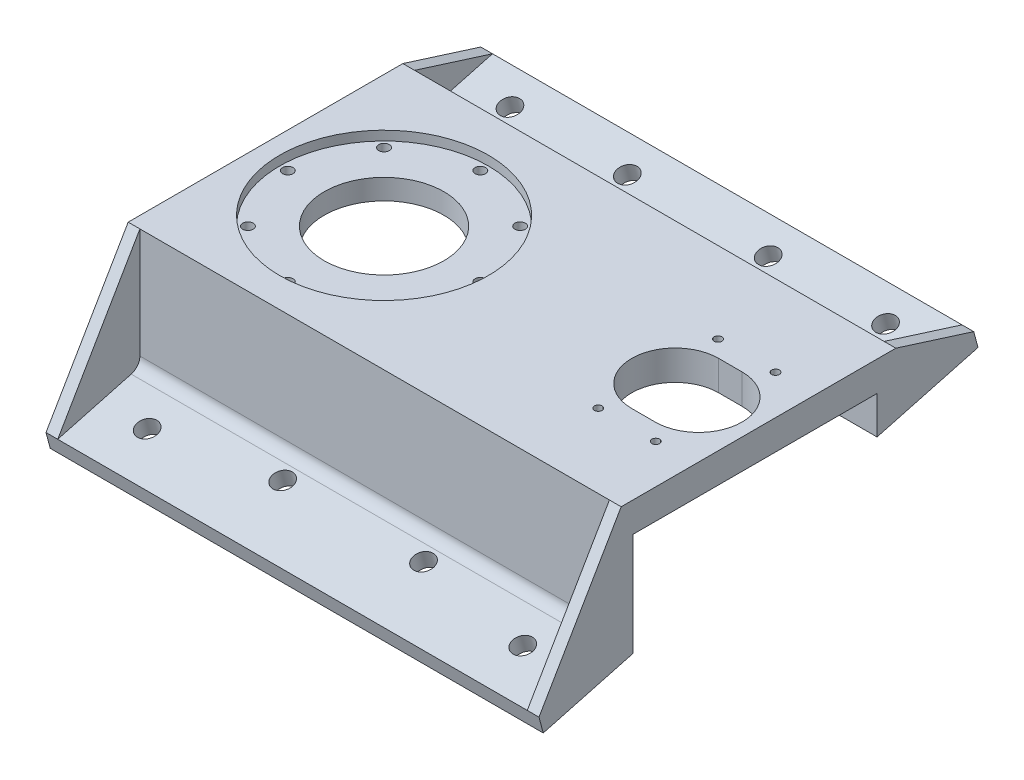
from build123d import *

# Parameters (mm, degrees)
EXTRUDE_1_DEPTH      = 30
SKETCH_2_R           = 44.45
CUT_EXTRUDE_1_DEPTH  = 4
SKETCH_3_R           = 25.5
SKETCH_3_R_2         = 2.25
CUT_EXTRUDE_2_DEPTH  = 188.619295383
CUT_EXTRUDE_3_DEPTH  = 189.215302247
SKETCH_5_R           = 1.65
CUT_EXTRUDE_4_DEPTH  = 189.215302247
EXTRUDE_START        = -30
EXTRUDE_2_DEPTH      = 30
CUT_EXTRUDE_5_DEPTH  = 198.040604952
CUT_EXTRUDE_7_DEPTH  = 233.432785983
CUT_EXTRUDE_8_DEPTH  = 233.432785983
CUT_EXTRUDE_9_DEPTH  = 233.432785983
FILLET_1_R           = 5
CUT_EXTRUDE_10_DEPTH = 233.432785983
EXTRUDE_START_2      = -5
EXTRUDE_3_DEPTH      = 5
EXTRUDE_4_DEPTH      = 5
SKETCH_14_R          = 4.25
CUT_EXTRUDE_11_DEPTH = 189.364728478
SKETCH_16_W          = 43
SKETCH_16_H          = 30
CUT_EXTRUDE_12_DEPTH = 233.432785983
EXTRUDE_7_REACH      = 188.592
SKETCH_18_W          = 210
SKETCH_18_H          = 5
EXTRUDE_8_DEPTH      = 210
EXTRUDE_9_DEPTH      = 5
EXTRUDE_10_DEPTH     = 5
SKETCH_22_R          = 4.25
CUT_EXTRUDE_13_DEPTH = 187.984035343
FILLET_2_R           = 5


with BuildPart() as part:
    # 草图1 → 凸台-拉伸1 (new body)
    with BuildSketch(Plane(origin=(0, 0, 0), x_dir=(1, 0, 0), z_dir=(0, 1, 0))):
        with BuildLine():
            Line((170, 31.93), (170, -31.93))
            ThreePointArc((170, -31.93), (167.781993847, -38.210172909), (162.111885646, -41.704453387))
            Line((162.111885646, -41.704453387), (15.839142344, -73.308400404))
            ThreePointArc((15.839142344, -73.308400404), (-75, 0), (15.839142344, 73.308400404))
            Line((15.839142344, 73.308400404), (162.111885646, 41.704453387))
            ThreePointArc((162.111885646, 41.704453387), (167.781993847, 38.210172909), (170, 31.93))
        make_face()
    extrude(amount=EXTRUDE_1_DEPTH)

    # 草图2 → 切除-拉伸1 (cut)
    with BuildSketch(Plane(origin=(0, 30, 0), x_dir=(1, 0, 0), z_dir=(0, 1, 0))):
        with Locations(Location((0, 0, 0), (0, 0, 270))):
            Circle(SKETCH_2_R)
    extrude(amount=-CUT_EXTRUDE_1_DEPTH, mode=Mode.SUBTRACT)

    # 草图3 → 切除-拉伸2 (cut, through all)
    with BuildSketch(Plane(origin=(0, 26, 0), x_dir=(1, 0, 0), z_dir=(0, 1, 0))):
        with Locations(Location((0, 0, 0), (0, 0, 270))):
            Circle(SKETCH_3_R)
        with Locations(Location((0, 41, 0), (0, 0, 270))):
            Circle(SKETCH_3_R_2)
        with Locations(Location((28.991378029, 28.991378029, 0), (0, 0, 270))):
            Circle(SKETCH_3_R_2)
        with Locations(Location((41, 0, 0), (0, 0, 270))):
            Circle(SKETCH_3_R_2)
        with Locations(Location((28.991378029, -28.991378029, 0), (0, 0, 270))):
            Circle(SKETCH_3_R_2)
        with Locations(Location((0, -41, 0), (0, 0, 270))):
            Circle(SKETCH_3_R_2)
        with Locations(Location((-28.991378029, -28.991378029, 0), (0, 0, 270))):
            Circle(SKETCH_3_R_2)
        with Locations(Location((-41, 0, 0), (0, 0, 270))):
            Circle(SKETCH_3_R_2)
        with Locations(Location((-28.991378029, 28.991378029, 0), (0, 0, 270))):
            Circle(SKETCH_3_R_2)
    extrude(amount=-CUT_EXTRUDE_2_DEPTH, mode=Mode.SUBTRACT)

    # 草图4 → 切除-拉伸3 (cut, through all)
    with BuildSketch(Plane(origin=(0, 30, 0), x_dir=(1, 0, 0), z_dir=(0, 1, 0))):
        with BuildLine():
            Line((124, 18.5), (134, 18.5))
            ThreePointArc((134, 18.5), (152.5, 0), (134, -18.5))
            Line((134, -18.5), (124, -18.5))
            ThreePointArc((124, -18.5), (105.5, 0), (124, 18.5))
        make_face()
    extrude(amount=-CUT_EXTRUDE_3_DEPTH, mode=Mode.SUBTRACT)

    # 草图5 → 切除-拉伸4 (cut, through all)
    with BuildSketch(Plane(origin=(0, 30, 0), x_dir=(1, 0, 0), z_dir=(0, 1, 0))):
        with Locations(Location((116.75, 25.5, 0), (0, 0, 270))):
            Circle(SKETCH_5_R)
        with Locations(Location((141.25, 25.5, 0), (0, 0, 270))):
            Circle(SKETCH_5_R)
        with Locations(Location((141.25, -25.5, 0), (0, 0, 270))):
            Circle(SKETCH_5_R)
        with Locations(Location((116.75, -25.5, 0), (0, 0, 270))):
            Circle(SKETCH_5_R)
    extrude(amount=-CUT_EXTRUDE_4_DEPTH, mode=Mode.SUBTRACT)

    # 草图6 → 凸台-拉伸2 (add)
    with BuildSketch(Plane(origin=(0, 30, 0), x_dir=(1, 0, 0), z_dir=(0, 1, 0)).offset(EXTRUDE_START)):
        with BuildLine():
            Line((158, 95), (-52, 95))
            Line((-52, 95), (-52, 54.046276467))
            ThreePointArc((-52, 54.046276467), (-20.48558667, 72.148047366), (15.839142344, 73.308400404))
            Line((15.839142344, 73.308400404), (158, 42.592874655))
            Line((158, 42.592874655), (158, 95))
        make_face()
        with BuildLine():
            ThreePointArc((15.839142344, -73.308400404), (-20.48558667, -72.148047366), (-52, -54.046276467))
            Line((-52, -54.046276467), (-52, -95))
            Line((-52, -95), (158, -95))
            Line((158, -95), (158, -42.592874655))
            Line((158, -42.592874655), (15.839142344, -73.308400404))
        make_face()
    extrude(amount=EXTRUDE_2_DEPTH)

    # 草图7 → 切除-拉伸5 (cut, through all)
    with BuildSketch(Plane(origin=(0, 30, 0), x_dir=(1, 0, 0), z_dir=(0, 1, 0))):
        with BuildLine():
            Line((-52, 54.046276467), (-52, -54.046276467))
            ThreePointArc((-52, -54.046276467), (-75, 0), (-52, 54.046276467))
        make_face()
        with BuildLine():
            Line((158, 42.592874655), (158, -42.592874655))
            Line((158, -42.592874655), (162.111885646, -41.704453387))
            ThreePointArc((162.111885646, -41.704453387), (167.781993847, -38.210172909), (170, -31.93))
            Line((170, -31.93), (170, 31.93))
            ThreePointArc((170, 31.93), (167.781993847, 38.210172909), (162.111885646, 41.704453387))
            Line((162.111885646, 41.704453387), (158, 42.592874655))
        make_face()
    extrude(amount=-CUT_EXTRUDE_5_DEPTH, mode=Mode.SUBTRACT)

    # 草图9 → 切除-拉伸7 (cut, through all)
    with BuildSketch(Plane.ZY.offset(52)):
        Polygon((-95, 20), (-60, 10.621778265), (-60, 30), (-95, 30), align=None)
    extrude(amount=-CUT_EXTRUDE_7_DEPTH, mode=Mode.SUBTRACT)

    # 草图10 → 切除-拉伸8 (cut, through all)
    with BuildSketch(Plane.ZY.offset(52)):
        Polygon((-95, 12.753066737), (-52, 1.231251463), (-52, 0), (-95, 0), align=None)
    extrude(amount=-CUT_EXTRUDE_8_DEPTH, mode=Mode.SUBTRACT)

    # 草图8 → 切除-拉伸9 (cut, through all)
    with BuildSketch(Plane.ZY.offset(52)):
        Polygon((0, 0), (52, 0), (52, 17.3), (-52, 17.3), (-52, 0), align=None)
    extrude(amount=-CUT_EXTRUDE_9_DEPTH, mode=Mode.SUBTRACT)

    # 圆角1
    fillet_1_edges = [part.edges().sort_by_distance(p)[0] for p in [
        (53, 10.621778265, -60),
    ]]
    fillet(fillet_1_edges, radius=FILLET_1_R)

    # 草图11 → 切除-拉伸10 (cut, through all)
    with BuildSketch(Plane.ZY.offset(52)):
        Polygon((-95, 12.753066737), (-93.188266684, 19.514547521), (-95, 20), align=None)
    extrude(amount=-CUT_EXTRUDE_10_DEPTH, mode=Mode.SUBTRACT)

    # 草图12 → 凸台-拉伸3 (add)
    with BuildSketch(Plane.ZY.offset(52).offset(EXTRUDE_START_2)):
        with BuildLine():
            Line((-93.188266684, 19.514547521), (-60, 30))
            Line((-60, 30), (-60, 17.137905129))
            ThreePointArc((-60, 17.137905129), (-61.956192855, 13.171138428), (-66.294095226, 12.308275998))
            Line((-66.294095226, 12.308275998), (-93.188266684, 19.514547521))
        make_face()
    extrude(amount=EXTRUDE_3_DEPTH)

    # 草图13 → 凸台-拉伸4 (add)
    with BuildSketch(Plane(origin=(158, 0, 0), x_dir=(0, 0, -1), z_dir=(1, 0, 0))):
        with BuildLine():
            Line((66.294095226, 12.308275998), (93.188266684, 19.514547521))
            Line((93.188266684, 19.514547521), (60, 30))
            Line((60, 30), (60, 17.137905129))
            ThreePointArc((60, 17.137905129), (61.956192855, 13.171138428), (66.294095226, 12.308275998))
        make_face()
    extrude(amount=-EXTRUDE_4_DEPTH)

    # 草图14 → 切除-拉伸11 (cut, through all)
    with BuildSketch(Plane(origin=(0, -5.089745962, -1.36379332), x_dir=(1, 0, 0), z_dir=(0, 0.9659258262890681, 0.2588190451025214))):
        with Locations(Location((-27, 82.063690052, 0), (0, 0, 270))):
            Circle(SKETCH_14_R)
        with Locations(Location((23, 82.063690052, 0), (0, 0, 270))):
            Circle(SKETCH_14_R)
        with Locations(Location((83, 82.063690052, 0), (0, 0, 270))):
            Circle(SKETCH_14_R)
        with Locations(Location((133, 82.063690052, 0), (0, 0, 270))):
            Circle(SKETCH_14_R)
    extrude(amount=-CUT_EXTRUDE_11_DEPTH, mode=Mode.SUBTRACT)

    # 草图16 → 切除-拉伸12 (cut, through all)
    with BuildSketch(Plane.ZY.offset(52)):
        with Locations((73.5, 15)):
            Rectangle(SKETCH_16_W, SKETCH_16_H)
    extrude(amount=-CUT_EXTRUDE_12_DEPTH, mode=Mode.SUBTRACT)

    # 凸台-拉伸7: up to this plane
    extrude_7_end = Plane(origin=(0, -11.851226746, -3.175526636), z_dir=(0, -0.9659258262890681, -0.25881904510252146))
    # 草图18 → 凸台-拉伸7 (add, up to the surface)
    with BuildSketch(Plane(origin=(0, 30, 0), x_dir=(1, 0, 0), z_dir=(0, 1, 0)), mode=Mode.PRIVATE) as extrude_7_sk1:
        with Locations((53, -54.5)):
            Rectangle(SKETCH_18_W, SKETCH_18_H)
    extrude_7_tool1 = split(extrude(extrude_7_sk1.sketch, amount=-EXTRUDE_7_REACH, mode=Mode.PRIVATE), bisect_by=extrude_7_end, keep=Keep.BOTH, mode=Mode.PRIVATE)
    add(extrude_7_tool1.solids().sort_by_distance((53, 30, 54.5))[0])

    # 草图19 → 凸台-拉伸8 (add)
    with BuildSketch(Plane.ZY.offset(52)):
        Polygon((57, -27.975210512), (90.188266684, -36.867979769), (92, -30.106498985), (57, -20.72827725), align=None)
    extrude(amount=-EXTRUDE_8_DEPTH)

    # 草图20 → 凸台-拉伸9 (add)
    with BuildSketch(Plane.ZY.offset(52)):
        Polygon((92, -30.106498985), (57, -20.72827725), (57, 30), align=None)
    extrude(amount=-EXTRUDE_9_DEPTH)

    # 草图21 → 凸台-拉伸10 (add)
    with BuildSketch(Plane(origin=(158, 0, 0), x_dir=(0, 0, -1), z_dir=(1, 0, 0))):
        Polygon((-57, 30), (-92, -30.106498985), (-57, -20.72827725), align=None)
    extrude(amount=-EXTRUDE_10_DEPTH)

    # 草图22 → 切除-拉伸13 (cut, through all)
    with BuildSketch(Plane(origin=(0, -5.089745962, -1.36379332), x_dir=(1, 0, 0), z_dir=(0, 0.9659258262890686, 0.25881904510251946))):
        with Locations(Location((-27, -77.936309948, 0), (0, 0, 270))):
            Circle(SKETCH_22_R)
        with Locations(Location((23, -69.936309948, 0), (0, 0, 270))):
            Circle(SKETCH_22_R)
        with Locations(Location((83, -69.936309948, 0), (0, 0, 270))):
            Circle(SKETCH_22_R)
        with Locations(Location((133, -77.936309948, 0), (0, 0, 270))):
            Circle(SKETCH_22_R)
    extrude(amount=-CUT_EXTRUDE_13_DEPTH, mode=Mode.SUBTRACT)

    # 圆角2
    fillet_2_edges = [part.edges().sort_by_distance(p)[0] for p in [
        (53, -20.72827725, 57),
    ]]
    fillet(fillet_2_edges, radius=FILLET_2_R)


solid = part.part
